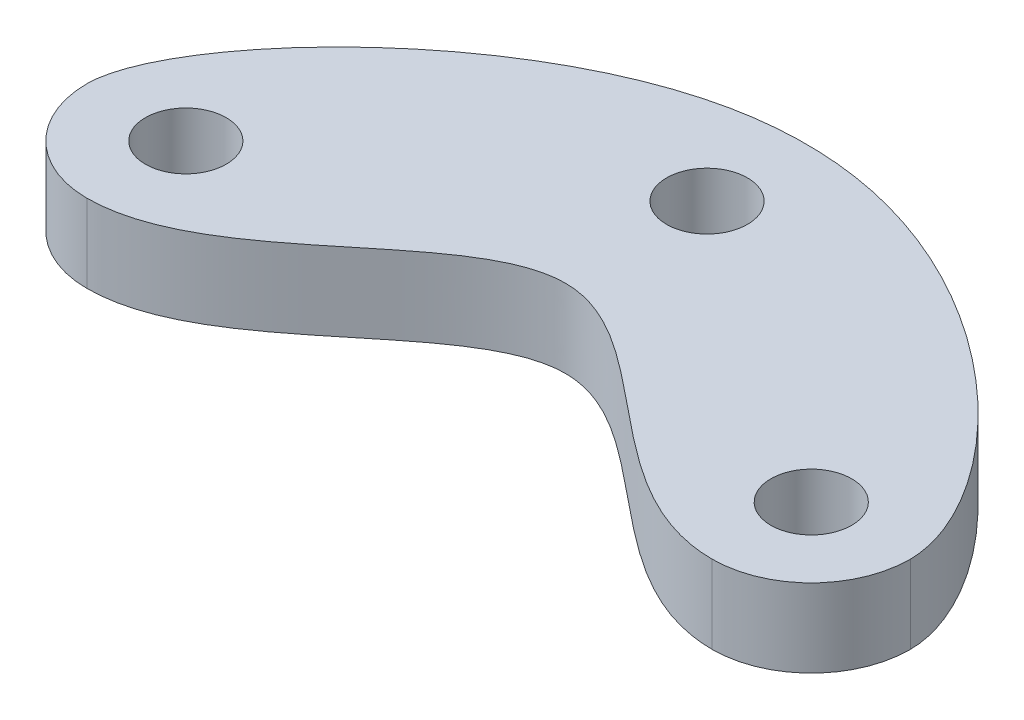
from build123d import *

# Parameters (mm, degrees)
SKETCH1_R           = 3.1
BOSS_EXTRUDE1_DEPTH = 6


with BuildPart() as part:
    # Sketch1 → Boss-Extrude1 (new body)
    with BuildSketch(Plane(origin=(0, 0, 0), x_dir=(1, 0, 0), z_dir=(0, 1, 0))):
        with BuildLine():
            ThreePointArc((-31.599916308, 0.035666759), (-29.38660688, -5.361386604), (-24, -7.6))
            add(Edge.make_bspline(
                [(-24, -7.6), (-14.668264125, -7.61499575), (0.011178466, 17.82220608), (14.645907193, -7.566074292), (24, -7.6)],
                knots=[0, 0, 0, 0, 0.5, 1, 1, 1, 1], degree=3))
            ThreePointArc((24, -7.6), (29.374011537, -5.374011537), (31.6, 0))
            add(Edge.make_bspline(
                [(-31.599916308, 0.035666759), (-31.577855131, 6.453958953), (-15.873953038, 23.775800665), (16.019610489, 23.704017602), (31.552058953, 7.12035463), (31.6, 0)],
                knots=[0, 0, 0, 0, 0.447467305, 0.547467305, 1, 1, 1, 1], degree=3))
        make_face()
        with Locations((-24, 0)):
            Circle(SKETCH1_R, mode=Mode.SUBTRACT)
        with Locations((24, 0)):
            Circle(SKETCH1_R, mode=Mode.SUBTRACT)
        with Locations((0, 16)):
            Circle(SKETCH1_R, mode=Mode.SUBTRACT)
    extrude(amount=BOSS_EXTRUDE1_DEPTH)


solid = part.part
